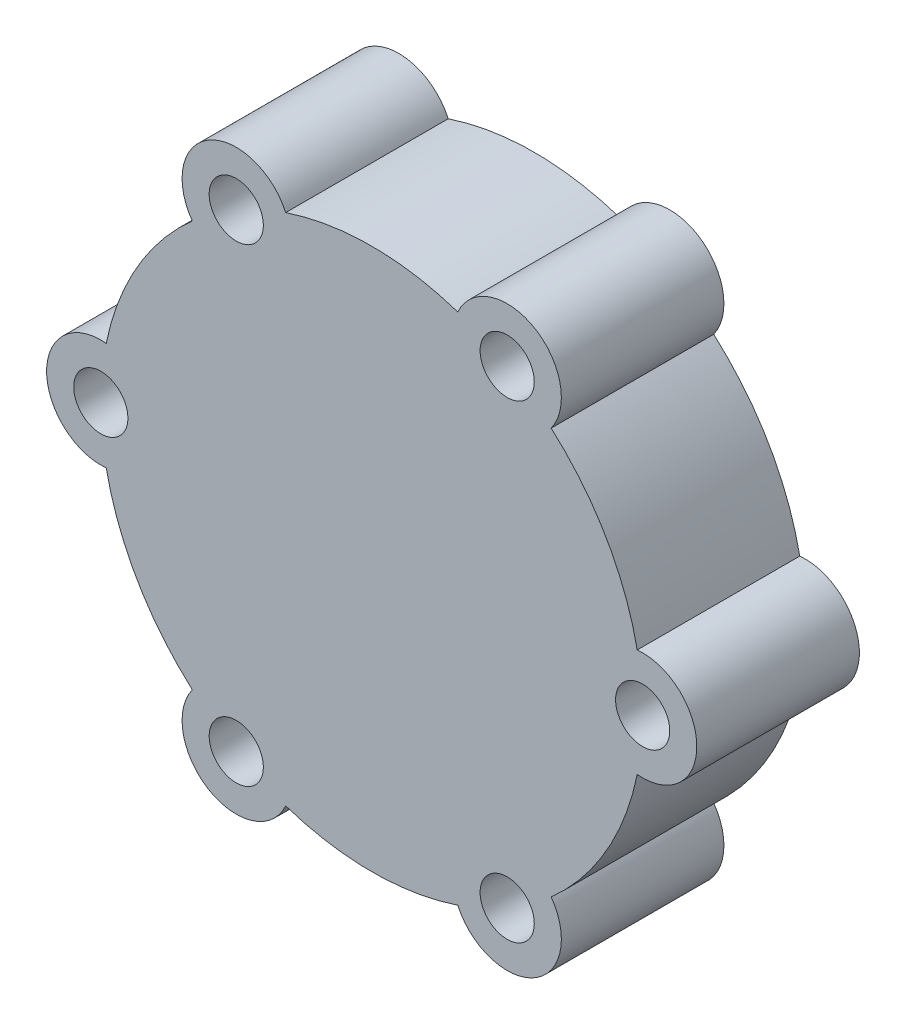
from build123d import *

# Parameters (mm, degrees)
SKETCH1_R           = 5
BOSS_EXTRUDE1_DEPTH = 30


with BuildPart() as part:
    # Sketch1 → Boss-Extrude1 (new body)
    with BuildSketch(Plane.XY):
        with BuildLine():
            ThreePointArc((49, 9.949874371), (43.301270189, 25), (33.11684397, 37.4603076))
            ThreePointArc((33.11684397, 37.4603076), (30, 51.961524227), (15.88315603, 47.410181971))
            ThreePointArc((15.88315603, 47.410181971), (0, 50), (-15.88315603, 47.410181971))
            ThreePointArc((-15.88315603, 47.410181971), (-30, 51.961524227), (-33.11684397, 37.4603076))
            ThreePointArc((-33.11684397, 37.4603076), (-43.301270189, 25), (-49, 9.949874371))
            ThreePointArc((-49, 9.949874371), (-60, 0), (-49, -9.949874371))
            ThreePointArc((-49, -9.949874371), (-43.301270189, -25), (-33.11684397, -37.4603076))
            ThreePointArc((-33.11684397, -37.4603076), (-30, -51.961524227), (-15.88315603, -47.410181971))
            ThreePointArc((-15.88315603, -47.410181971), (0, -50), (15.88315603, -47.410181971))
            ThreePointArc((15.88315603, -47.410181971), (30, -51.961524227), (33.11684397, -37.4603076))
            ThreePointArc((33.11684397, -37.4603076), (43.301270189, -25), (49, -9.949874371))
            ThreePointArc((49, -9.949874371), (60, 0), (49, 9.949874371))
        make_face()
        with Locations((50, 0)):
            Circle(SKETCH1_R, mode=Mode.SUBTRACT)
        with Locations((25, -43.301270189)):
            Circle(SKETCH1_R, mode=Mode.SUBTRACT)
        with Locations((-25, -43.301270189)):
            Circle(SKETCH1_R, mode=Mode.SUBTRACT)
        with Locations((-50, 0)):
            Circle(SKETCH1_R, mode=Mode.SUBTRACT)
        with Locations((-25, 43.301270189)):
            Circle(SKETCH1_R, mode=Mode.SUBTRACT)
        with Locations((25, 43.301270189)):
            Circle(SKETCH1_R, mode=Mode.SUBTRACT)
    extrude(amount=BOSS_EXTRUDE1_DEPTH)


solid = part.part
